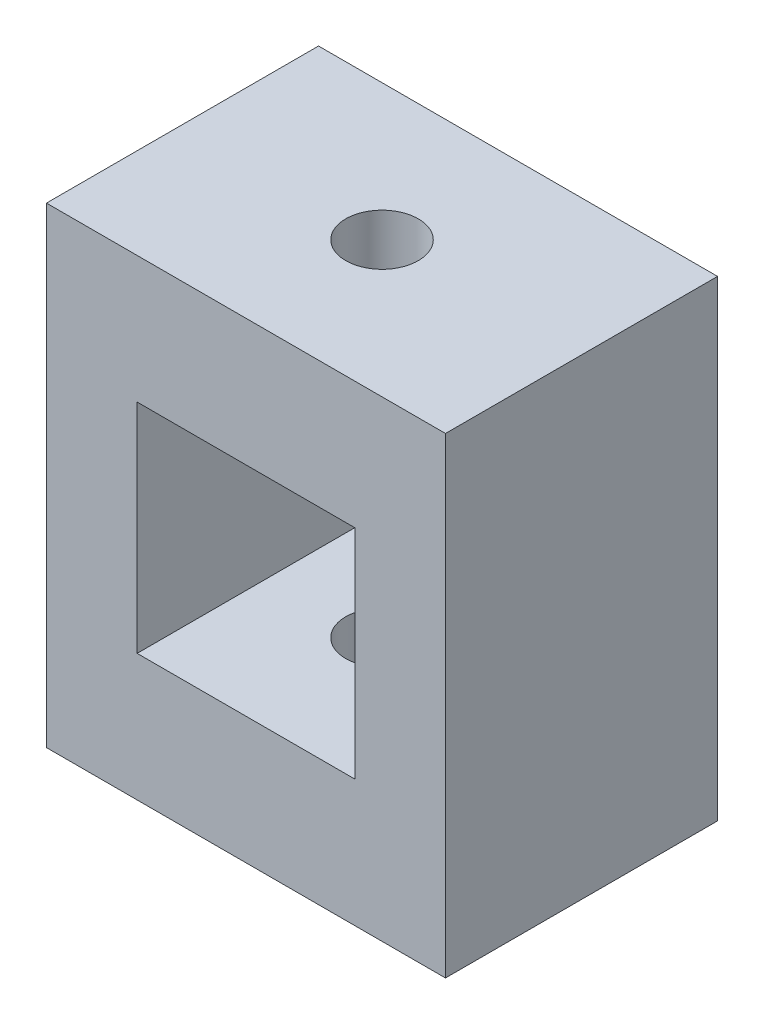
from build123d import *

# Parameters (mm, degrees)
SKETCH1_W           = 22
SKETCH1_H           = 26
SKETCH1_W_2         = 12
SKETCH1_H_2         = 12
BOSS_EXTRUDE1_DEPTH = 15
SKETCH2_R           = 2
CUT_EXTRUDE1_DEPTH  = 42


with BuildPart() as part:
    # Sketch1 → Boss-Extrude1 (new body)
    with BuildSketch(Plane.XY):
        with Locations((11, 13)):
            Rectangle(SKETCH1_W, SKETCH1_H)
        with Locations((11, 13)):
            Rectangle(SKETCH1_W_2, SKETCH1_H_2, mode=Mode.SUBTRACT)
    extrude(amount=BOSS_EXTRUDE1_DEPTH)

    # Sketch2 → Cut-Extrude1 (cut)
    with BuildSketch(Plane(origin=(0, 26, 0), x_dir=(1, 0, 0), z_dir=(0, 1, 0))):
        with Locations(Location((11, -7.5, 0), (0, 0, 270))):
            Circle(SKETCH2_R)
    extrude(amount=-CUT_EXTRUDE1_DEPTH, mode=Mode.SUBTRACT)


solid = part.part
